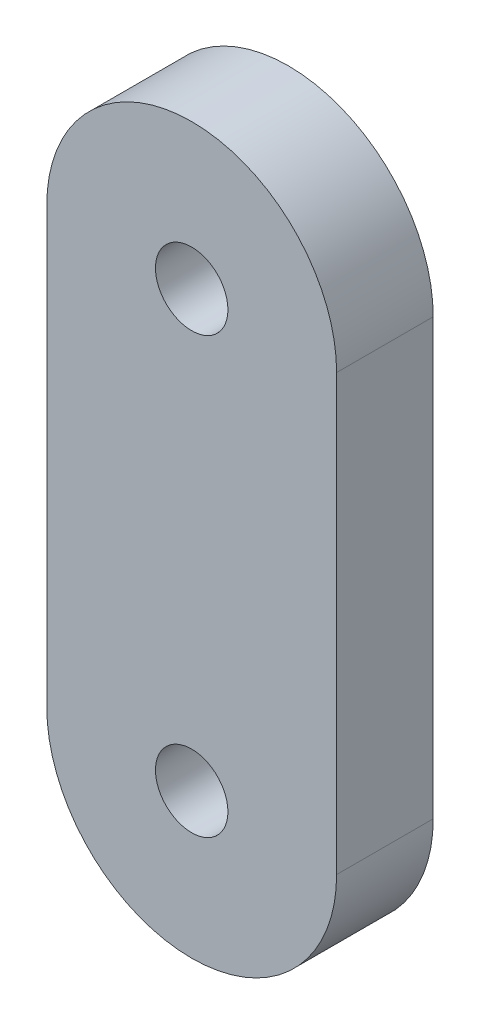
from build123d import *

# Parameters (mm, degrees)
SKETCH_1_R      = 3
EXTRUDE_1_DEPTH = 8


with BuildPart() as part:
    # 草图1 → 凸台-拉伸1 (new body)
    with BuildSketch(Plane.XY.offset(8)):
        with BuildLine():
            Line((12, -36), (12, 0))
            ThreePointArc((12, 0), (0, 12), (-12, 0))
            Line((-12, 0), (-12, -36))
            ThreePointArc((-12, -36), (0, -48), (12, -36))
        make_face()
        with Locations((0, -36)):
            Circle(SKETCH_1_R, mode=Mode.SUBTRACT)
        Circle(SKETCH_1_R, mode=Mode.SUBTRACT)
    extrude(amount=-EXTRUDE_1_DEPTH)


solid = part.part
